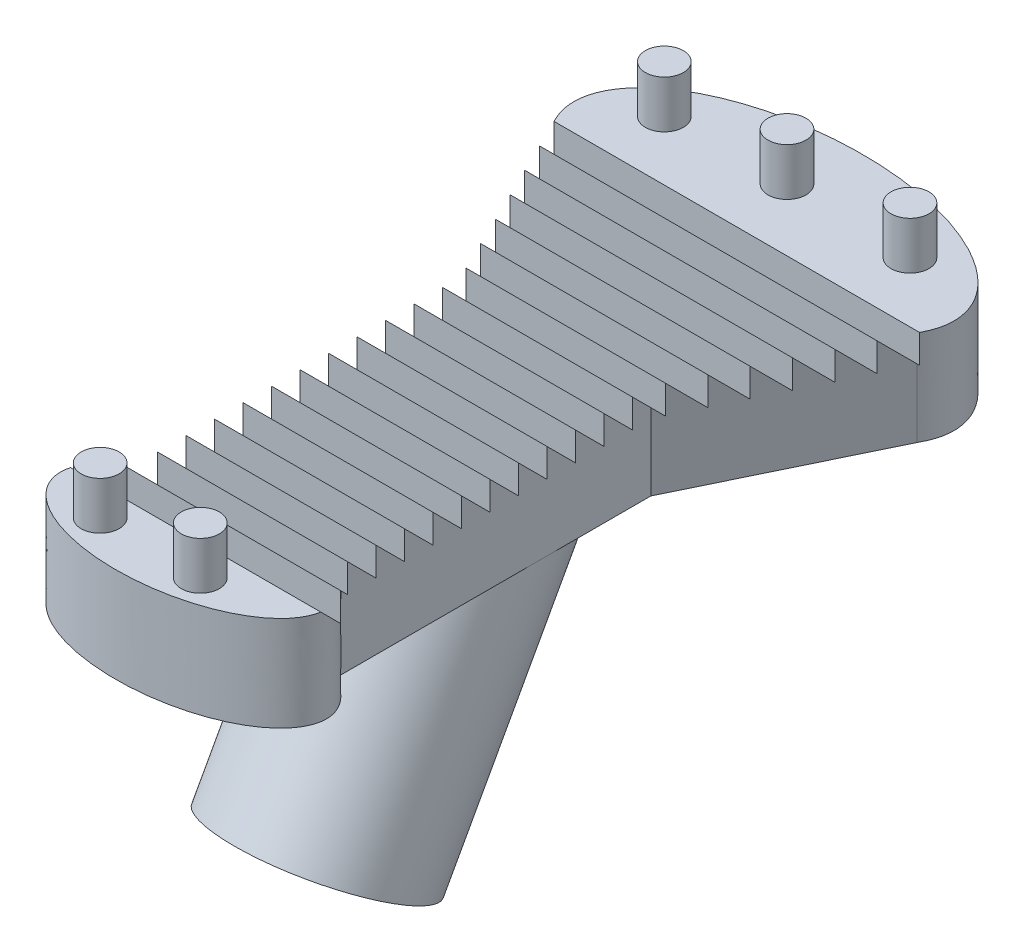
from build123d import *

# Parameters (mm, degrees)
EXTRUDE_2_DEPTH          = 10
SKETCH_8_R               = 5.05
CUT_EXTRUDE_1_DEPTH      = 25
CUT_EXTRUDE_2_DEPTH      = 65.589732479
CUT_EXTRUDE_2_DEPTH_BACK = 65.589732479
SKETCH_10_R              = 2
EXTRUDE_3_DEPTH          = 5


with BuildPart() as part:
    # Эскиз3 → Бобышка-Вытянуть2 (new body)
    with BuildSketch(Plane(origin=(0, 0, 0), x_dir=(1, 0, 0), z_dir=(0, 1, 0))):
        with BuildLine():
            Line((-19.39560228, 10.463829147), (-10, -8.913147143))
            Line((-10, -8.913147143), (-10, -43.218962734))
            add(Edge.make_bspline(
                [(-10, -43.218962734), (-22.788555386, -51.374706713), (-4.404292307, -53.617098764), (13.979970771, -55.859490815), (13.24081494, -46.053725186)],
                knots=[2.388060049, 2.388060049, 2.388060049, 4.335622678, 4.335622678, 6.283185307, 6.283185307, 6.283185307], degree=2, weights=[1, 0.562176345, 1, 0.562176345, 1]))
            add(Edge.make_bspline(
                [(13.24081494, -46.053725186), (13.063736407, -43.704571568), (10, -42.095048909)],
                knots=[0, 0, 0, 0.677674692, 0.677674692, 0.677674692], degree=2, weights=[1, 0.943141758, 1]))
            Line((10, -42.095048909), (10, -8.913147143))
            Line((10, -8.913147143), (19.134669767, 9.976263053))
            add(Edge.make_bspline(
                [(19.134669767, 9.976263053), (20, 11.452562535), (20, 12.995624946)],
                knots=[5.987949263, 5.987949263, 5.987949263, 6.283185307, 6.283185307, 6.283185307], degree=2, weights=[1, 0.989124231, 1]))
            add(Edge.make_bspline(
                [(20, 12.995624946), (20, 24.73727953), (-2.458450162, 23.293965899), (-24.916900324, 21.850652268), (-19.39560228, 10.463829147)],
                knots=[0, 0, 0, 1.694030518, 1.694030518, 3.388061035, 3.388061035, 3.388061035], degree=2, weights=[1, 0.66222258, 1, 0.66222258, 1]))
        make_face()
    extrude(amount=EXTRUDE_2_DEPTH)

    # Эскиз6 → Повернуть1 (revolve)
    with BuildSketch(Plane(origin=(0, 0, 0), x_dir=(0, 0, -1), z_dir=(1, 0, 0))):
        Polygon((-8.913147143, 0), (-25.247586294, -29.635848206), (-34.005408961, -24.808784696), (-20.331510337, 0), align=None)
    revolve(axis=Axis((0, 0, 20.331510337), (0, -0.8757822667380798, 0.48270635097035014)))

    # Эскиз8 → Вырез-Вытянуть1 (cut)
    with BuildSketch(Plane(origin=(0, -33.403842498, 18.411250756), x_dir=(1, 0, 0), z_dir=(0, -0.8757822667380799, 0.4827063509703501))):
        with Locations((0, 18.049384131)):
            Circle(SKETCH_8_R)
    extrude(amount=-CUT_EXTRUDE_1_DEPTH, mode=Mode.SUBTRACT)

    # Эскиз9 → Вырез-Вытянуть2 (cut, two sides: drawn at the far end of the back side and taken through both)
    with BuildSketch(Plane(origin=(0, 0, 0), x_dir=(0, 0, -1), z_dir=(1, 0, 0)).offset(-CUT_EXTRUDE_2_DEPTH_BACK)):
        Polygon((-43.856616521, 10), (-46.856616521, 10), (-43.856616521, 7), align=None)
        Polygon((-40.856616521, 10), (-43.856616521, 10), (-40.856616521, 7), align=None)
        Polygon((-37.856616521, 10), (-40.856616521, 10), (-37.856616521, 7), align=None)
        Polygon((-34.856616521, 10), (-37.856616521, 10), (-34.856616521, 7), align=None)
        Polygon((-31.856616521, 10), (-34.856616521, 10), (-31.856616521, 7), align=None)
        Polygon((-28.856616521, 10), (-31.856616521, 10), (-28.856616521, 7), align=None)
        Polygon((-25.856616521, 10), (-28.856616521, 10), (-25.856616521, 7), align=None)
        Polygon((-22.856616521, 10), (-25.856616521, 10), (-22.856616521, 7), align=None)
        Polygon((-19.856616521, 10), (-22.856616521, 10), (-19.856616521, 7), align=None)
        Polygon((-16.856616521, 10), (-19.856616521, 10), (-16.856616521, 7), align=None)
        Polygon((-13.856616521, 10), (-16.856616521, 10), (-13.856616521, 7), align=None)
        Polygon((-10.856616521, 10), (-13.856616521, 10), (-10.856616521, 7), align=None)
        Polygon((-7.856616521, 10), (-10.856616521, 10), (-7.856616521, 7), align=None)
        Polygon((-4.856616521, 10), (-7.856616521, 10), (-4.856616521, 7), align=None)
        Polygon((-1.856616521, 10), (-4.856616521, 10), (-1.856616521, 7), align=None)
        Polygon((1.143383479, 10), (-1.856616521, 10), (1.143383479, 7), align=None)
        Polygon((4.143383479, 10), (1.143383479, 10), (4.143383479, 7), align=None)
        Polygon((7.143383479, 10), (4.143383479, 10), (7.143383479, 7), align=None)
        Polygon((10.143383479, 10), (7.143383479, 10), (10.143383479, 7), align=None)
    extrude(amount=CUT_EXTRUDE_2_DEPTH + CUT_EXTRUDE_2_DEPTH_BACK, mode=Mode.SUBTRACT)

    # Эскиз10 → Бобышка-Вытянуть3 (add)
    with BuildSketch(Plane(origin=(0, 10, 0), x_dir=(1, 0, 0), z_dir=(0, 1, 0))):
        with Locations((-13.887887631, 16.40209469)):
            Circle(SKETCH_10_R)
        with Locations((-1.273826777, 16.698241985)):
            Circle(SKETCH_10_R)
        with Locations((11.913593592, 16.454746241)):
            Circle(SKETCH_10_R)
        with Locations((-6.999810032, -49.869756455)):
            Circle(SKETCH_10_R)
        with Locations((3.742496984, -50.068502191)):
            Circle(SKETCH_10_R)
    extrude(amount=EXTRUDE_3_DEPTH)


solid = part.part
